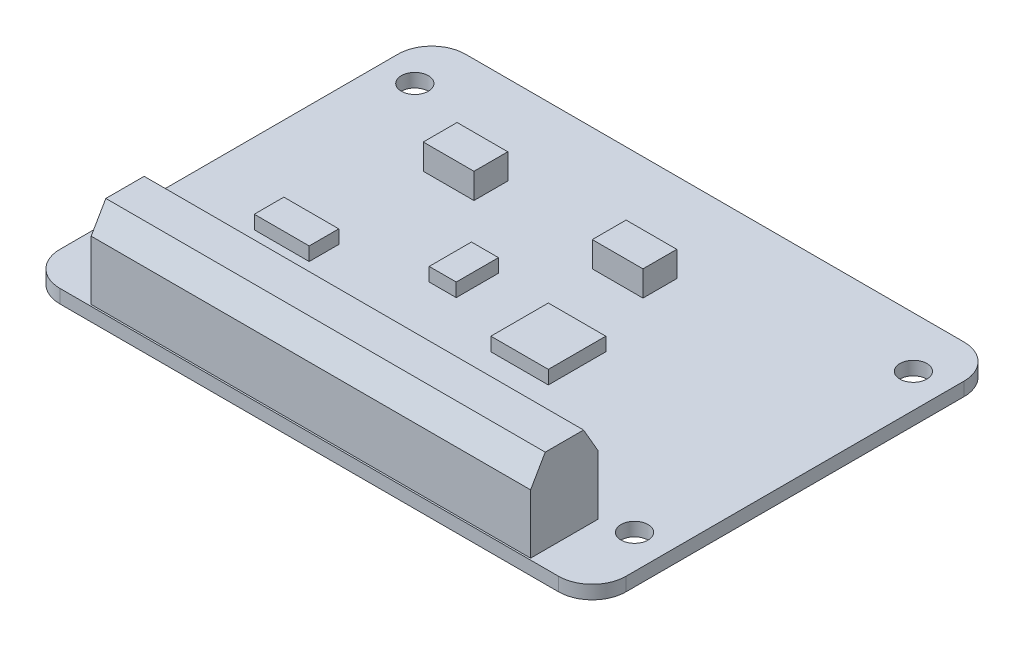
from build123d import *
from OCP.BRepFilletAPI import BRepFilletAPI_MakeChamfer

# Parameters (mm, degrees)
SKETCH_1_W              = 67
SKETCH_1_H              = 48
EXTRUDE_1_DEPTH         = 1.6
FILLET_1_R              = 4
HOLE_WIZARD_3_2_3_2_1_D = 3.2
SKETCH_4_W              = 6.8
SKETCH_4_H              = 6.8
SKETCH_4_W_2            = 3.2
SKETCH_4_H_2            = 5
SKETCH_4_W_3            = 6.5
SKETCH_4_H_3            = 3.5
EXTRUDE_2_DEPTH         = 1.6
SKETCH_5_W              = 52
SKETCH_5_H              = 8
EXTRUDE_4_DEPTH         = 10
CHAMFER_1_SIZE          = 3
CHAMFER_1_SIZE2         = 1.732050808
SKETCH_7_W              = 6
SKETCH_7_H              = 4
EXTRUDE_5_DEPTH         = 3


with BuildPart() as part:
    # 草图1 → 凸台-拉伸1 (new body)
    with BuildSketch(Plane(origin=(0, 0, 0), x_dir=(1, 0, 0), z_dir=(0, 1, 0))):
        with Locations((33.5, 24)):
            Rectangle(SKETCH_1_W, SKETCH_1_H)
    extrude(amount=EXTRUDE_1_DEPTH)

    # 圆角1
    fillet_1_edges = [part.edges().sort_by_distance(p)[0] for p in [
        (0, 0.8, -48),
        (67, 0.8, -48),
        (67, 0.8, 0),
        (0, 0.8, 0),
    ]]
    fillet(fillet_1_edges, radius=FILLET_1_R)

    # Ø3.2 (3.2) 直径孔1 (through all)
    with Locations(Plane(origin=(0, 1.6, 0), x_dir=(1, 0, 0), z_dir=(0, 1, 0))):
        with Locations((4, 9), (4, 42), (63, 42), (63, 9)):
            Hole(HOLE_WIZARD_3_2_3_2_1_D / 2)

    # 草图4 → 凸台-拉伸2 (add)
    with BuildSketch(Plane(origin=(0, 1.6, 0), x_dir=(1, 0, 0), z_dir=(0, 1, 0))):
        with Locations((39.4, 22.4)):
            Rectangle(SKETCH_4_W, SKETCH_4_H)
        with Locations((26.8, 25)):
            Rectangle(SKETCH_4_W_2, SKETCH_4_H_2)
        with Locations((12.75, 19.25)):
            Rectangle(SKETCH_4_W_3, SKETCH_4_H_3)
    extrude(amount=EXTRUDE_2_DEPTH)

    # 草图5 → 凸台-拉伸4 (add)
    with BuildSketch(Plane(origin=(0, 1.6, 0), x_dir=(1, 0, 0), z_dir=(0, 1, 0))):
        with Locations((33.5, 4.2)):
            Rectangle(SKETCH_5_W, SKETCH_5_H)
    extrude(amount=EXTRUDE_4_DEPTH)

    # 倒角1: one chamfer whose edges measure the first distance from different faces: ONE call of the kernel's chamfer builder (chamfer() names one face for all edges)
    chamfer_1_edges_1 = [part.edges().sort_by_distance(p)[0] for p in [
        (33.5, 11.6, -0.2),
    ]]
    chamfer_1_side_1 = [part.faces().sort_by_distance(p)[0] for p in [
        (33.5, 6.6, -0.2),
    ]]
    chamfer_1_edges_2 = [part.edges().sort_by_distance(p)[0] for p in [
        (33.5, 11.6, -8.2),
    ]]
    chamfer_1_side_2 = [part.faces().sort_by_distance(p)[0] for p in [
        (33.5, 6.6, -8.2),
    ]]
    chamfer_1 = BRepFilletAPI_MakeChamfer(part.part.solid().wrapped)
    for e in chamfer_1_edges_1:
        chamfer_1.Add(CHAMFER_1_SIZE, CHAMFER_1_SIZE2, e.wrapped, chamfer_1_side_1[0].wrapped)  # the first distance lies on this face
    for e in chamfer_1_edges_2:
        chamfer_1.Add(CHAMFER_1_SIZE, CHAMFER_1_SIZE2, e.wrapped, chamfer_1_side_2[0].wrapped)  # the first distance lies on this face
    add(Compound.cast(chamfer_1.Shape()), mode=Mode.REPLACE)

    # 草图7 → 凸台-拉伸5 (add)
    with BuildSketch(Plane(origin=(0, 1.6, 0), x_dir=(1, 0, 0), z_dir=(0, 1, 0))):
        with Locations((16.5, 35.5)):
            Rectangle(SKETCH_7_W, SKETCH_7_H)
        with Locations((36.5, 35.5)):
            Rectangle(SKETCH_7_W, SKETCH_7_H)
    extrude(amount=EXTRUDE_5_DEPTH)


solid = part.part
